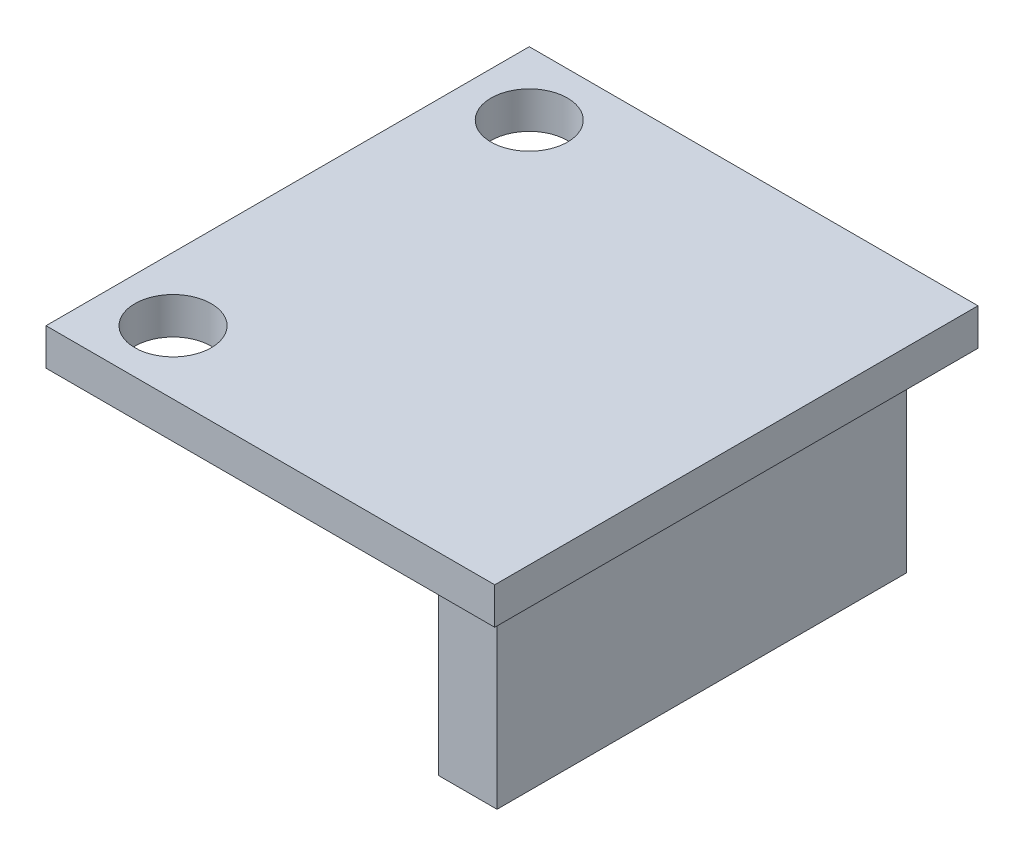
from build123d import *

# Parameters (mm, degrees)
SKETCH1_W      = 19.5
SKETCH1_H      = 20.99999991
SKETCH1_R      = 1.660700018
EXTRUDE1_DEPTH = 1.6
SKETCH2_W      = 2.54
SKETCH2_H      = 17.8
EXTRUDE2_DEPTH = 8.4


with BuildPart() as part:
    # Sketch1 → Extrude1 (new body)
    with BuildSketch(Plane(origin=(0, 0, 0), x_dir=(1, 0, 0), z_dir=(0, 1, 0))):
        with Locations((-18.583272271, -5.406568708)):
            Rectangle(SKETCH1_W, SKETCH1_H)
        with Locations(Location((-25.572572253, -13.145868645, 0), (0, 0, 270))):
            Circle(SKETCH1_R, mode=Mode.SUBTRACT)
        with Locations(Location((-25.572572253, 2.332731229, 0), (0, 0, 90))):
            Circle(SKETCH1_R, mode=Mode.SUBTRACT)
    extrude(amount=EXTRUDE1_DEPTH)

    # Sketch2 → Extrude2 (add)
    with BuildSketch(Plane.XZ):
        with Locations((-11.603272271, 5.406568708)):
            Rectangle(SKETCH2_W, SKETCH2_H)
    extrude(amount=EXTRUDE2_DEPTH)


solid = part.part
